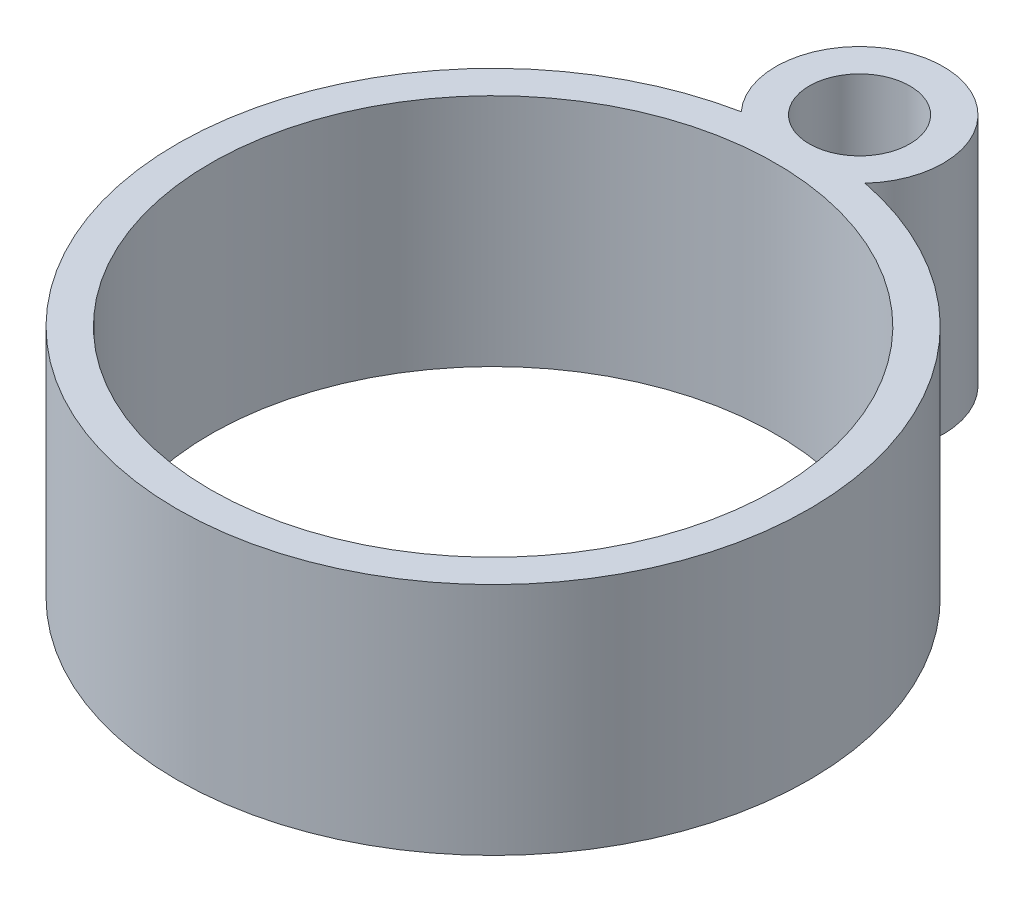
from build123d import *

# Parameters (mm, degrees)
SKETCH2_R           = 9.435
SKETCH2_R_2         = 8.435
SKETCH2_R_3         = 2.5
SKETCH2_R_4         = 1.5
BOSS_EXTRUDE1_DEPTH = 7


with BuildPart() as part:
    # Sketch2 → Boss-Extrude1 (new body)
    # profile 1 of 2: a face of its own
    with BuildSketch(Plane(origin=(0, 0, 0), x_dir=(1, 0, 0), z_dir=(0, 1, 0))):
        Circle(SKETCH2_R)
        with Locations(Location((0, 0, 0), (0, 0, 270))):
            Circle(SKETCH2_R_2, mode=Mode.SUBTRACT)
    # profile 2 of 2: a face of its own
    with BuildSketch(Plane(origin=(0, 0, 0), x_dir=(1, 0, 0), z_dir=(0, 1, 0))):
        with Locations((0, 10.935)):
            Circle(SKETCH2_R_3)
        with Locations(Location((0, 10.935, 0), (0, 0, 270))):
            Circle(SKETCH2_R_4, mode=Mode.SUBTRACT)
    extrude(amount=BOSS_EXTRUDE1_DEPTH)


solid = part.part
